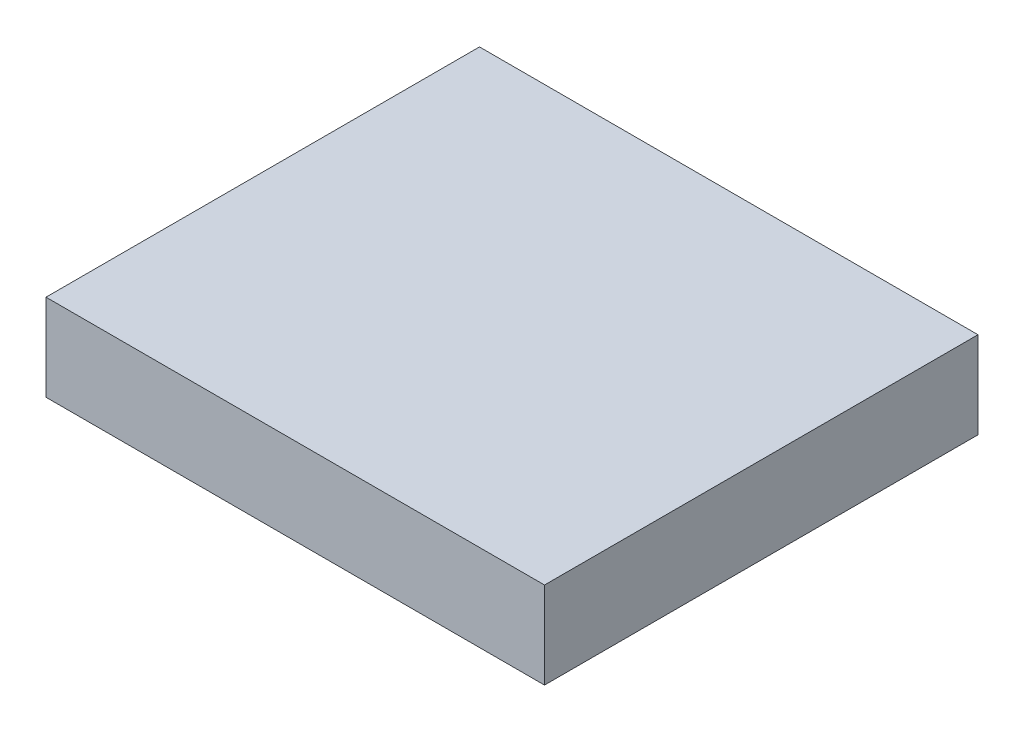
from build123d import *

# Parameters (mm, degrees)
SKETCH1_W           = 115
SKETCH1_H           = 100
BOSS_EXTRUDE1_DEPTH = 20


with BuildPart() as part:
    # Sketch1 → Boss-Extrude1 (new body)
    with BuildSketch(Plane(origin=(0, 0, 0), x_dir=(1, 0, 0), z_dir=(0, 1, 0))):
        with Locations((-5.131142509, 12.961786283)):
            Rectangle(SKETCH1_W, SKETCH1_H)
    extrude(amount=BOSS_EXTRUDE1_DEPTH)


solid = part.part
